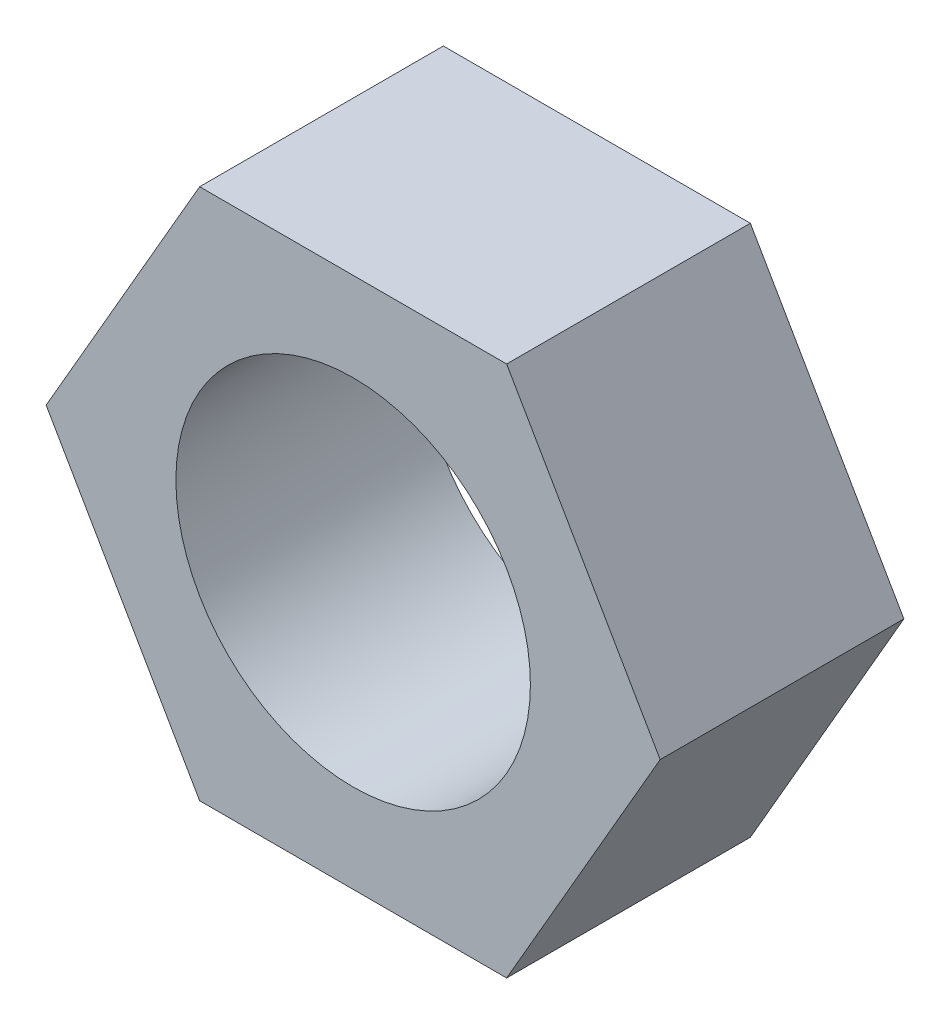
from build123d import *

# Parameters (mm, degrees)
SKETCH2_R           = 4
BOSS_EXTRUDE1_DEPTH = 5.5


with BuildPart() as part:
    # Sketch2 → Boss-Extrude1 (new body)
    with BuildSketch(Plane.XY):
        Polygon((-6.92820323, 0), (-3.464101615, -6), (3.464101615, -6), (6.92820323, 0), (3.464101615, 6), (-3.464101615, 6), align=None)
        Circle(SKETCH2_R, mode=Mode.SUBTRACT)
    extrude(amount=BOSS_EXTRUDE1_DEPTH)


solid = part.part
